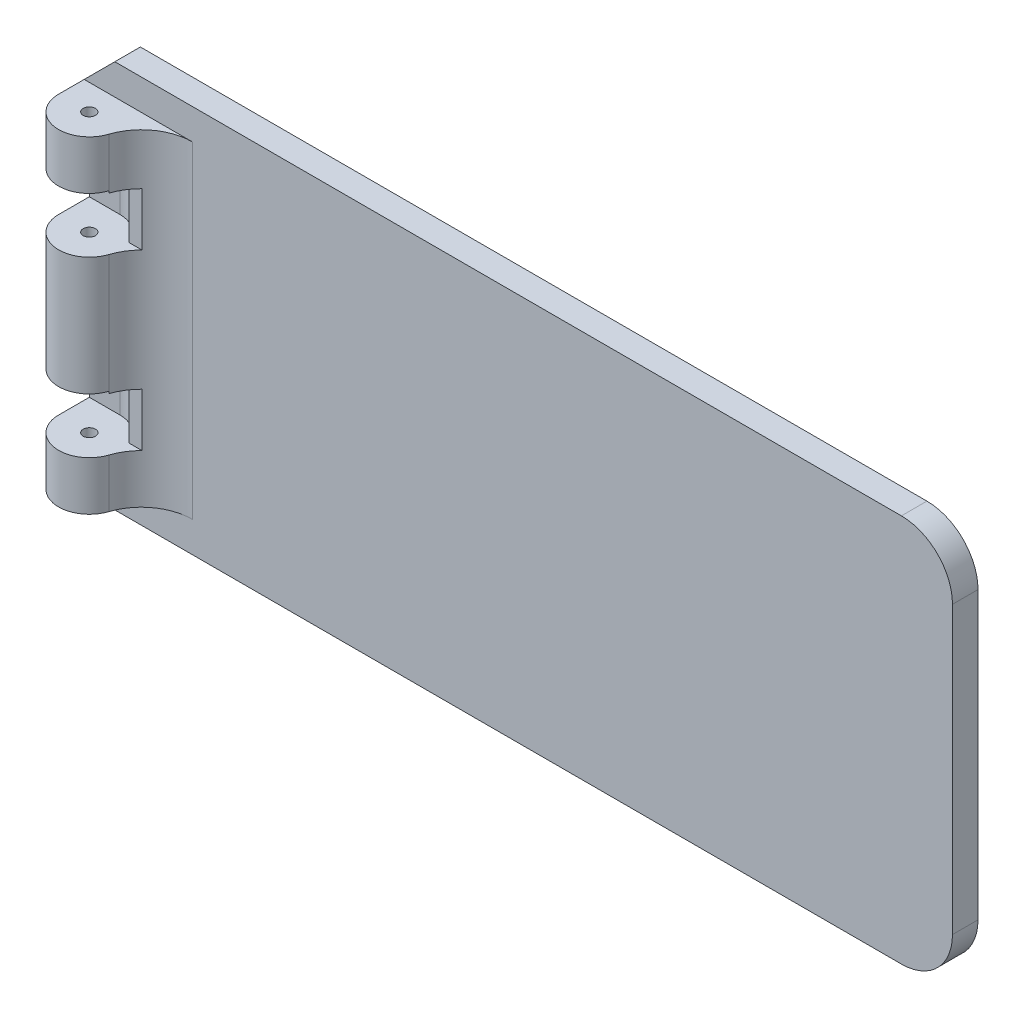
from build123d import *

# Parameters (mm, degrees)
BOSS_EXTRUDE1_DEPTH     = 38
FILLET1_R               = 5
CUT_EXTRUDE2_DEPTH      = 2.7
CUT_EXTRUDE2_DEPTH_BACK = 2.7
SKETCH4_R               = 3
CUT_EXTRUDE3_DEPTH      = 2.7
CUT_EXTRUDE3_DEPTH_BACK = 2.7
SKETCH5_R               = 3
SKETCH6_W               = 15.806991546
SKETCH6_H               = 7.262468959
CUT_EXTRUDE4_DEPTH      = 3
SKETCH7_W               = 28.198471628
SKETCH7_H               = 7.72700603
CUT_EXTRUDE5_DEPTH      = 3
CHAMFER1_SIZE           = 3
FILLET2_R               = 5
SKETCH8_W               = 6.878152115
SKETCH8_H               = 5.2
SKETCH8_W_2             = 6.400502662
CUT_EXTRUDE6_DEPTH      = 2


with BuildPart() as part:
    # Sketch1 → Boss-Extrude1 (new body)
    with BuildSketch(Plane(origin=(0, 0, 0), x_dir=(1, 0, 0), z_dir=(0, 1, 0))):
        with BuildLine():
            Line((85, 0), (3, 0))
            Line((3, 0), (3, -2))
            ThreePointArc((3, -2), (3.866025404, -2.127718677), (4.658312395, -2.5))
            Line((4.658312395, -2.5), (85, -2.5))
            Line((85, -2.5), (85, 0))
        make_face()
        with BuildLine():
            Line((3, -2), (3, 0))
            Line((3, 0), (0, 0))
            Line((0, 0), (0, -2.5))
            Line((0, -2.5), (1.341687605, -2.5))
            ThreePointArc((1.341687605, -2.5), (2.133974596, -2.127718677), (3, -2))
        make_face()
        with BuildLine():
            ThreePointArc((0, -5), (0.356617963, -3.581362835), (1.341687605, -2.5))
            Line((1.341687605, -2.5), (0, -2.5))
            Line((0, -2.5), (0, -5))
        make_face()
        with BuildLine():
            Line((3, -4.4), (3, -2.5))
            Line((3, -2.5), (0, -5))
            ThreePointArc((0, -5), (0.878679656, -7.121320344), (3, -8))
            Line((3, -8), (3, -5.6))
            ThreePointArc((3, -5.6), (2.4, -5), (3, -4.4))
        make_face()
        with BuildLine():
            Line((4.658312395, -2.5), (3, -2.5))
            Line((3, -2.5), (3, -4.4))
            ThreePointArc((3, -4.4), (3.424264069, -4.575735931), (3.6, -5))
            ThreePointArc((3.6, -5), (3.424264069, -5.424264069), (3, -5.6))
            Line((3, -5.6), (3, -8))
            ThreePointArc((3, -8), (5.121320344, -7.121320344), (6, -5))
            ThreePointArc((6, -5), (5.643382037, -3.581362835), (4.658312395, -2.5))
        make_face()
        with BuildLine():
            Line((0, -5), (3, -2.5))
            Line((3, -2.5), (1.341687605, -2.5))
            ThreePointArc((1.341687605, -2.5), (0.356617963, -3.581362835), (0, -5))
        make_face()
        with BuildLine():
            Line((3, -2.5), (3, -2))
            ThreePointArc((3, -2), (2.133974596, -2.127718677), (1.341687605, -2.5))
            Line((1.341687605, -2.5), (3, -2.5))
        make_face()
        with BuildLine():
            ThreePointArc((4.658312395, -2.5), (3.866025404, -2.127718677), (3, -2))
            Line((3, -2), (3, -2.5))
            Line((3, -2.5), (4.658312395, -2.5))
        make_face()
    extrude(amount=BOSS_EXTRUDE1_DEPTH)

    # Fillet1
    fillet1_edges = [part.edges().sort_by_distance(p)[0] for p in [
        (4.658312395, 19, 2.5),
    ]]
    fillet(fillet1_edges, radius=FILLET1_R)

    # Sketch4 → Cut-Extrude2 (cut, two sides: drawn at the far end of the back side and taken through both)
    with BuildSketch(Plane(origin=(0, 27.5, 0), x_dir=(1, 0, 0), z_dir=(0, 1, 0)).offset(-CUT_EXTRUDE2_DEPTH_BACK)):
        with Locations((3, -5)):
            Circle(SKETCH4_R)
        with BuildLine():
            ThreePointArc((0, -5), (0.878679656, -2.878679656), (3, -2))
            Line((3, -2), (0, -2))
            Line((0, -2), (0, -5))
        make_face()
    extrude(amount=CUT_EXTRUDE2_DEPTH + CUT_EXTRUDE2_DEPTH_BACK, mode=Mode.SUBTRACT)

    # Sketch5 → Cut-Extrude3 (cut, two sides: drawn at the far end of the back side and taken through both)
    with BuildSketch(Plane(origin=(0, 10.5, 0), x_dir=(1, 0, 0), z_dir=(0, 1, 0)).offset(-CUT_EXTRUDE3_DEPTH_BACK)):
        with Locations((3, -5)):
            Circle(SKETCH5_R)
        with BuildLine():
            ThreePointArc((0, -5), (0.878679656, -2.878679656), (3, -2))
            Line((3, -2), (0, -2))
            Line((0, -2), (0, -5))
        make_face()
    extrude(amount=CUT_EXTRUDE3_DEPTH + CUT_EXTRUDE3_DEPTH_BACK, mode=Mode.SUBTRACT)

    # Sketch6 → Cut-Extrude4 (cut)
    with BuildSketch(Plane(origin=(0, 38, 0), x_dir=(1, 0, 0), z_dir=(0, 1, 0))):
        with Locations((5.822770624, -6.13123448)):
            Rectangle(SKETCH6_W, SKETCH6_H)
    extrude(amount=-CUT_EXTRUDE4_DEPTH, mode=Mode.SUBTRACT)

    # Sketch7 → Cut-Extrude5 (cut)
    with BuildSketch(Plane.XZ):
        with Locations((11.372216332, 6.363503015)):
            Rectangle(SKETCH7_W, SKETCH7_H)
    extrude(amount=-CUT_EXTRUDE5_DEPTH, mode=Mode.SUBTRACT)

    # Chamfer1
    chamfer1_edges = [part.edges().sort_by_distance(p)[0] for p in [
        (0, 38, 1.25),
        (0, 0, 1.25),
    ]]
    chamfer(chamfer1_edges, length=CHAMFER1_SIZE)

    # Fillet2
    fillet2_edges = [part.edges().sort_by_distance(p)[0] for p in [
        (85, 38, 1.25),
        (85, 0, 1.25),
    ]]
    fillet(fillet2_edges, radius=FILLET2_R)

    # Sketch8 → Cut-Extrude6 (cut)
    with BuildSketch(Plane.XY.offset(5.9375)):
        with Locations((6.922338589, 10.4)):
            Rectangle(SKETCH8_W, SKETCH8_H)
        with Locations((6.683513862, 27.4)):
            Rectangle(SKETCH8_W_2, SKETCH8_H)
    extrude(amount=-CUT_EXTRUDE6_DEPTH, mode=Mode.SUBTRACT)


solid = part.part
